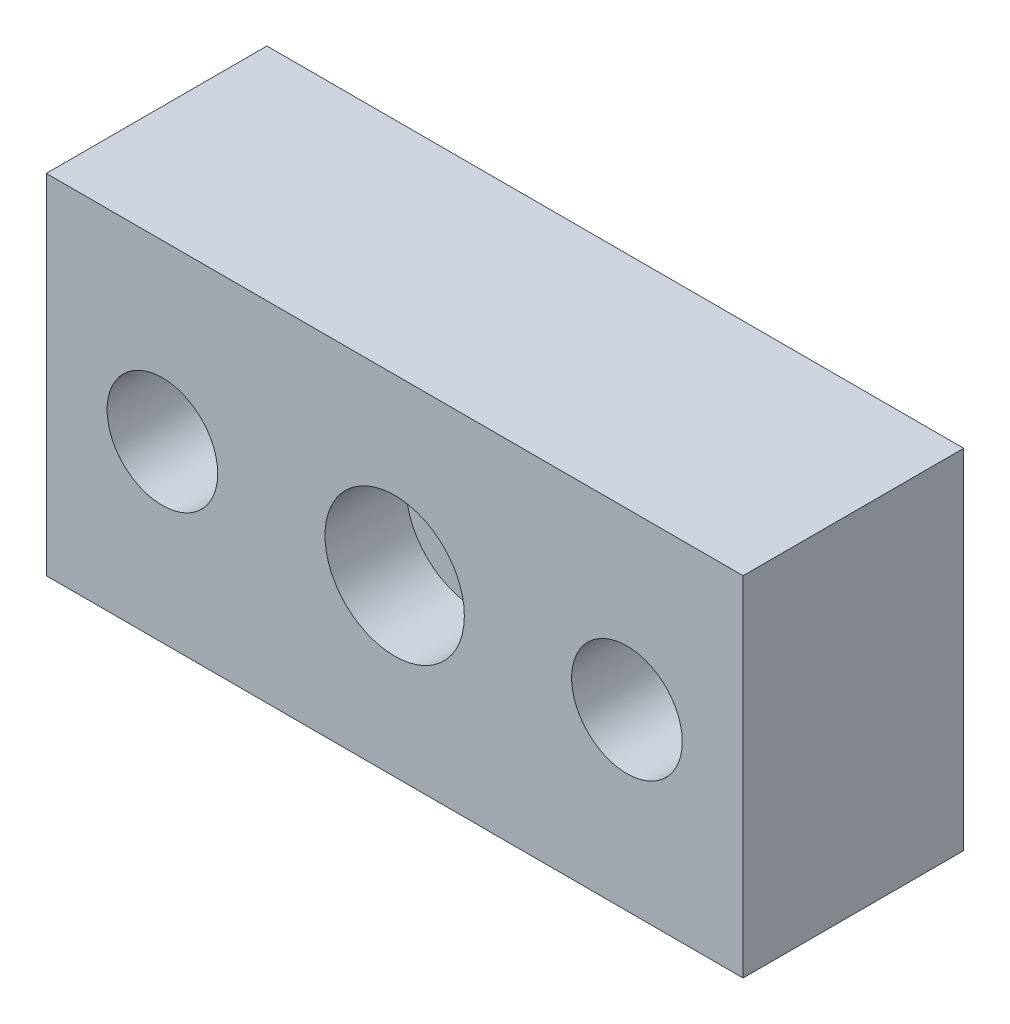
from build123d import *

# Parameters (mm, degrees)
SKETCH1_W           = 30
SKETCH1_H           = 15
SKETCH1_R           = 1
SKETCH1_R_2         = 2.38125
BOSS_EXTRUDE1_DEPTH = 9.5
SKETCH2_R           = 3
CUT_EXTRUDE1_DEPTH  = 3.5
CUT_EXTRUDE2_START  = -3
SKETCH3_R           = 3
CUT_EXTRUDE2_DEPTH  = 3


with BuildPart() as part:
    # Sketch1 → Boss-Extrude1 (new body)
    with BuildSketch(Plane.XY):
        Rectangle(SKETCH1_W, SKETCH1_H)
        Circle(SKETCH1_R, mode=Mode.SUBTRACT)
        with Locations((10, 0)):
            Circle(SKETCH1_R_2, mode=Mode.SUBTRACT)
        with Locations((-10, 0)):
            Circle(SKETCH1_R_2, mode=Mode.SUBTRACT)
    extrude(amount=BOSS_EXTRUDE1_DEPTH)

    # Sketch2 → Cut-Extrude1 (cut)
    with BuildSketch(Plane.XY.offset(9.5)):
        Circle(SKETCH2_R)
    extrude(amount=-CUT_EXTRUDE1_DEPTH, mode=Mode.SUBTRACT)

    # Sketch3 → Cut-Extrude2 (cut)
    with BuildSketch(Plane(origin=(0, 0, 0), x_dir=(-1, 0, 0), z_dir=(0, 0, -1)).offset(CUT_EXTRUDE2_START)):
        with Locations(Location((0, 0, 0), (0, 0, 180))):
            Circle(SKETCH3_R)
    extrude(amount=CUT_EXTRUDE2_DEPTH, mode=Mode.SUBTRACT)


solid = part.part
